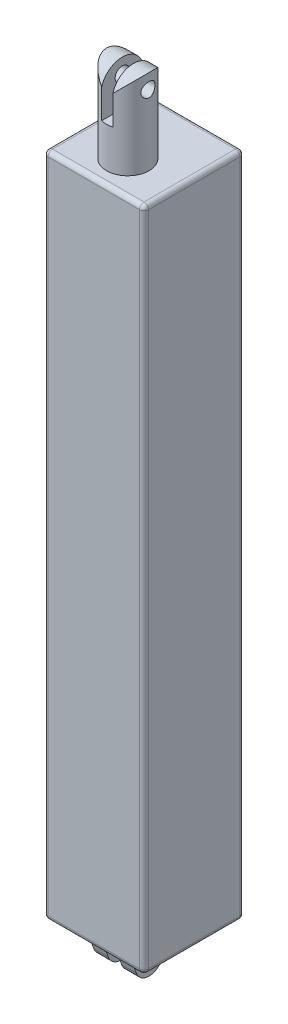
from build123d import *

# Parameters (mm, degrees)
SKETCH1_W               = 44.958
SKETCH1_H               = 44.958
BOSS_EXTRUDE1_DEPTH     = 298.45
SKETCH2_R               = 9.525
BOSS_EXTRUDE2_DEPTH     = 38.1
CUT_EXTRUDE1_DEPTH      = 341.282867193
CUT_EXTRUDE1_DEPTH_BACK = 341.282867193
CUT_EXTRUDE2_DEPTH      = 341.282867193
CUT_EXTRUDE2_DEPTH_BACK = 341.282867193
SKETCH4_R               = 3.175
SKETCH5_W               = 5
SKETCH5_H               = 20
CUT_EXTRUDE3_DEPTH      = 32
SKETCH6_R               = 3.175
BOSS_EXTRUDE3_DEPTH     = 9.525
SKETCH7_W               = 6
SKETCH7_H               = 44.958
CUT_EXTRUDE4_DEPTH      = 19.05
FILLET1_R               = 2


with BuildPart() as part:
    # Sketch1 → Boss-Extrude1 (new body)
    with BuildSketch(Plane(origin=(0, 0, 0), x_dir=(1, 0, 0), z_dir=(0, 1, 0))):
        Rectangle(SKETCH1_W, SKETCH1_H)
    extrude(amount=BOSS_EXTRUDE1_DEPTH)

    # Sketch2 → Boss-Extrude2 (add)
    with BuildSketch(Plane(origin=(0, 298.45, 0), x_dir=(1, 0, 0), z_dir=(0, 1, 0))):
        with Locations(Location((0, -7.239, 0), (0, 0, 90))):
            Circle(SKETCH2_R)
    extrude(amount=BOSS_EXTRUDE2_DEPTH)

    # Sketch3 → Cut-Extrude1 (cut, two sides: drawn at the far end of the back side and taken through both)
    with BuildSketch(Plane.ZY.offset(22.479).offset(-CUT_EXTRUDE1_DEPTH_BACK)):
        with BuildLine():
            Line((-2.286, 327.025), (-2.286, 352.425))
            Line((-2.286, 352.425), (16.764, 352.425))
            Line((16.764, 352.425), (16.764, 327.025))
            ThreePointArc((16.764, 327.025), (7.239, 336.55), (-2.286, 327.025))
        make_face()
    extrude(amount=CUT_EXTRUDE1_DEPTH + CUT_EXTRUDE1_DEPTH_BACK, mode=Mode.SUBTRACT)

    # Sketch4 → Cut-Extrude2 (cut, two sides: drawn at the far end of the back side and taken through both)
    with BuildSketch(Plane.ZY.offset(22.479).offset(-CUT_EXTRUDE2_DEPTH_BACK)):
        with Locations((7.239, 329.946)):
            Circle(SKETCH4_R)
    extrude(amount=CUT_EXTRUDE2_DEPTH + CUT_EXTRUDE2_DEPTH_BACK, mode=Mode.SUBTRACT)

    # Sketch5 → Cut-Extrude3 (cut)
    with BuildSketch(Plane(origin=(0, 348.45, 0), x_dir=(1, 0, 0), z_dir=(0, 1, 0))):
        with Locations((0, -7.239)):
            Rectangle(SKETCH5_W, SKETCH5_H)
    extrude(amount=-CUT_EXTRUDE3_DEPTH, mode=Mode.SUBTRACT)

    # Sketch6 → Boss-Extrude3 (add, symmetric)
    with BuildSketch(Plane(origin=(0, 0, 0), x_dir=(0, 0, -1), z_dir=(1, 0, 0))):
        with BuildLine():
            Line((2.114129326, 0), (-16.592129326, 0))
            Line((-16.592129326, 0), (-12.967366216, -9.958954794))
            ThreePointArc((-12.967366216, -9.958954794), (-7.239, -13.97), (-1.510633784, -9.958954794))
            Line((-1.510633784, -9.958954794), (2.114129326, 0))
        make_face()
        with Locations(Location((-7.239, -7.874, 0), (0, 0, 180))):
            Circle(SKETCH6_R, mode=Mode.SUBTRACT)
    extrude(amount=BOSS_EXTRUDE3_DEPTH, both=True)

    # Sketch7 → Cut-Extrude4 (cut)
    with BuildSketch(Plane.XZ):
        Rectangle(SKETCH7_W, SKETCH7_H)
    extrude(amount=CUT_EXTRUDE4_DEPTH, mode=Mode.SUBTRACT)

    # Fillet1
    fillet1_edges = [part.edges().sort_by_distance(p)[0] for p in [
        (-22.479, 298.45, 0),
        (0, 298.45, 22.479),
        (22.479, 298.45, 0),
        (0, 0, 22.479),
        (-22.479, 0, 0),
        (0, 0, -22.479),
        (22.479, 0, 0),
        (0, 298.45, -22.479),
        (22.479, 149.225, 22.479),
        (-22.479, 149.225, 22.479),
        (-22.479, 149.225, -22.479),
        (22.479, 149.225, -22.479),
    ]]
    fillet(fillet1_edges, radius=FILLET1_R)


solid = part.part
